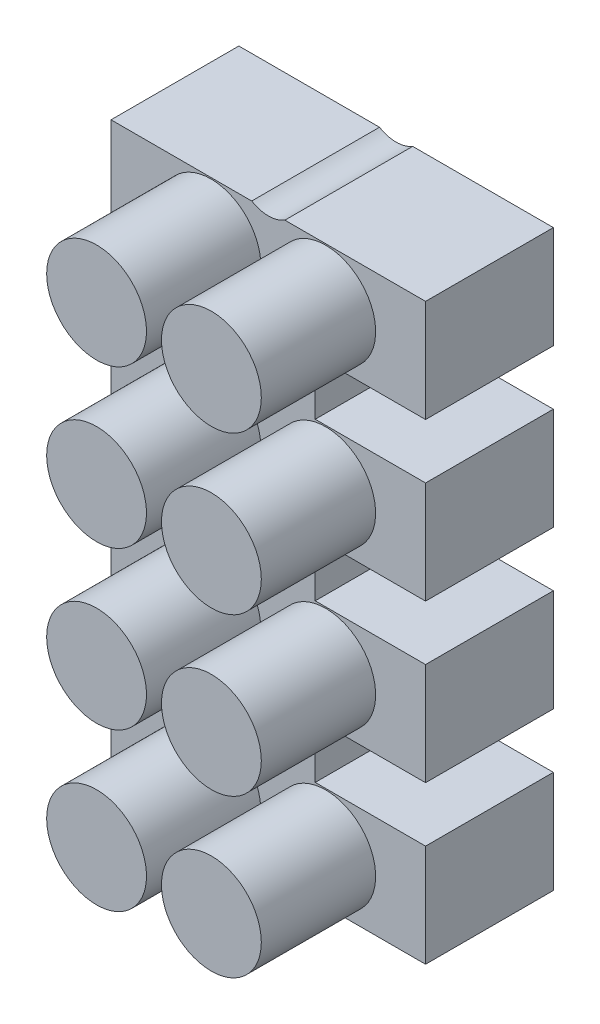
from build123d import *

# Parameters (mm, degrees)
SKETCH1_W                 = 16.002
SKETCH1_H                 = 13.208
BOSS_EXTRUDE1_DEPTH       = 6.5024
SKETCH2_W                 = 5.6134
SKETCH2_H                 = 2.794
CUT_EXTRUDE1_DEPTH        = 13.243774857
F_4_CLEARANCE_HOLE1_D     = 3.2639
SKETCH5_R                 = 2.54
BOSS_EXTRUDE2_DEPTH       = 5.8166
SKETCH6_W                 = 16.002
SKETCH6_H                 = 5.207
CUT_EXTRUDE2_DEPTH        = 13.243774857
LPATTERN1_COUNT           = 4
LPATTERN1_PITCH           = 8.001
LPATTERN1_COPY_1_SKETCH_W = 5.6134
LPATTERN1_COPY_1_SKETCH_H = 2.794
LPATTERN1_COPY_1_DEPTH    = 13.243774857
LPATTERN1_COPY_2_SKETCH_W = 5.6134
LPATTERN1_COPY_2_SKETCH_H = 2.794
LPATTERN1_COPY_2_DEPTH    = 13.243774857
LPATTERN1_COPY_3_SKETCH_W = 5.6134
LPATTERN1_COPY_3_SKETCH_H = 2.794
LPATTERN1_COPY_3_DEPTH    = 13.243774857
LPATTERN1_COPY_4_SKETCH_R = 2.54
LPATTERN1_COPY_4_DEPTH    = 5.8166
LPATTERN1_COPY_5_SKETCH_R = 2.54
LPATTERN1_COPY_5_DEPTH    = 5.8166
LPATTERN1_COPY_6_SKETCH_R = 2.54
LPATTERN1_COPY_6_DEPTH    = 5.8166
SKETCH7_W                 = 16.002
SKETCH7_H                 = 8.001
CUT_EXTRUDE3_DEPTH        = 33.296836622


with BuildPart() as part:
    # Sketch1 → Boss-Extrude1 (new body)
    with BuildSketch(Plane.XY):
        Rectangle(SKETCH1_W, SKETCH1_H)
    boss_extrude1 = extrude(amount=BOSS_EXTRUDE1_DEPTH)

    # Sketch2 → Cut-Extrude1 (cut, through all)
    with BuildSketch(Plane.XY.offset(6.5024)):
        with Locations((5.1943, 0)):
            Rectangle(SKETCH2_W, SKETCH2_H)
    cut_extrude1 = extrude(amount=-CUT_EXTRUDE1_DEPTH, mode=Mode.SUBTRACT)

    # #4 Clearance Hole1 (through all)
    with Locations(Plane.XY.offset(6.5024)):
        with Locations((0, 0)):
            f_4_clearance_hole1 = Hole(F_4_CLEARANCE_HOLE1_D / 2)

    # Sketch5 → Boss-Extrude2 (add)
    with BuildSketch(Plane.XY.offset(6.5024)):
        with Locations(Location((2.921, -4.0005, 0), (0, 0, 180))):
            Circle(SKETCH5_R)
    boss_extrude2 = extrude(amount=BOSS_EXTRUDE2_DEPTH)

    # Sketch6 → Cut-Extrude2 (cut, through all)
    with BuildSketch(Plane.XY.offset(6.5024)):
        with Locations((0, 4.0005)):
            Rectangle(SKETCH6_W, SKETCH6_H)
    extrude(amount=-CUT_EXTRUDE2_DEPTH, mode=Mode.SUBTRACT)

    # Mirror4: Cut-Extrude1, Boss-Extrude2 across plane
    add(cut_extrude1.mirror(Plane(origin=(0, 0, 0), x_dir=(0, 0, 1), z_dir=(1, 0, 0))), mode=Mode.SUBTRACT)
    add(boss_extrude2.mirror(Plane(origin=(0, 0, 0), x_dir=(0, 0, 1), z_dir=(1, 0, 0))))

    # LPattern1: Boss-Extrude1, Cut-Extrude1, #4 Clearance Hole1, Boss-Extrude2 ×4
    with Locations(*[(0, i * LPATTERN1_PITCH, 0) for i in range(1, LPATTERN1_COUNT)]):
        add(boss_extrude1)
        add(cut_extrude1, mode=Mode.SUBTRACT)
        add(f_4_clearance_hole1, mode=Mode.SUBTRACT)
        add(boss_extrude2)

    # LPattern1 copy 1 sketch → LPattern1 copy 1 (cut, through all)
    with BuildSketch(Plane(origin=(0, 8.001, 6.5024), x_dir=(-1, 0, 0), z_dir=(0, 0, 1))):
        with Locations((5.1943, 0)):
            Rectangle(LPATTERN1_COPY_1_SKETCH_W, LPATTERN1_COPY_1_SKETCH_H)
    extrude(amount=-LPATTERN1_COPY_1_DEPTH, mode=Mode.SUBTRACT)

    # LPattern1 copy 2 sketch → LPattern1 copy 2 (cut, through all)
    with BuildSketch(Plane(origin=(0, 16.002, 6.5024), x_dir=(-1, 0, 0), z_dir=(0, 0, 1))):
        with Locations((5.1943, 0)):
            Rectangle(LPATTERN1_COPY_2_SKETCH_W, LPATTERN1_COPY_2_SKETCH_H)
    extrude(amount=-LPATTERN1_COPY_2_DEPTH, mode=Mode.SUBTRACT)

    # LPattern1 copy 3 sketch → LPattern1 copy 3 (cut, through all)
    with BuildSketch(Plane(origin=(0, 24.003, 6.5024), x_dir=(-1, 0, 0), z_dir=(0, 0, 1))):
        with Locations((5.1943, 0)):
            Rectangle(LPATTERN1_COPY_3_SKETCH_W, LPATTERN1_COPY_3_SKETCH_H)
    extrude(amount=-LPATTERN1_COPY_3_DEPTH, mode=Mode.SUBTRACT)

    # LPattern1 copy 4 sketch → LPattern1 copy 4 (add)
    with BuildSketch(Plane(origin=(0, 8.001, 6.5024), x_dir=(-1, 0, 0), z_dir=(0, 0, 1))):
        with Locations((2.921, 4.0005)):
            Circle(LPATTERN1_COPY_4_SKETCH_R)
    extrude(amount=LPATTERN1_COPY_4_DEPTH)

    # LPattern1 copy 5 sketch → LPattern1 copy 5 (add)
    with BuildSketch(Plane(origin=(0, 16.002, 6.5024), x_dir=(-1, 0, 0), z_dir=(0, 0, 1))):
        with Locations((2.921, 4.0005)):
            Circle(LPATTERN1_COPY_5_SKETCH_R)
    extrude(amount=LPATTERN1_COPY_5_DEPTH)

    # LPattern1 copy 6 sketch → LPattern1 copy 6 (add)
    with BuildSketch(Plane(origin=(0, 24.003, 6.5024), x_dir=(-1, 0, 0), z_dir=(0, 0, 1))):
        with Locations((2.921, 4.0005)):
            Circle(LPATTERN1_COPY_6_SKETCH_R)
    extrude(amount=LPATTERN1_COPY_6_DEPTH)

    # Sketch7 → Cut-Extrude3 (cut, through all)
    with BuildSketch(Plane.XY.offset(6.5024)):
        with Locations((0, 26.6065)):
            Rectangle(SKETCH7_W, SKETCH7_H)
    extrude(amount=-CUT_EXTRUDE3_DEPTH, mode=Mode.SUBTRACT)


solid = part.part
